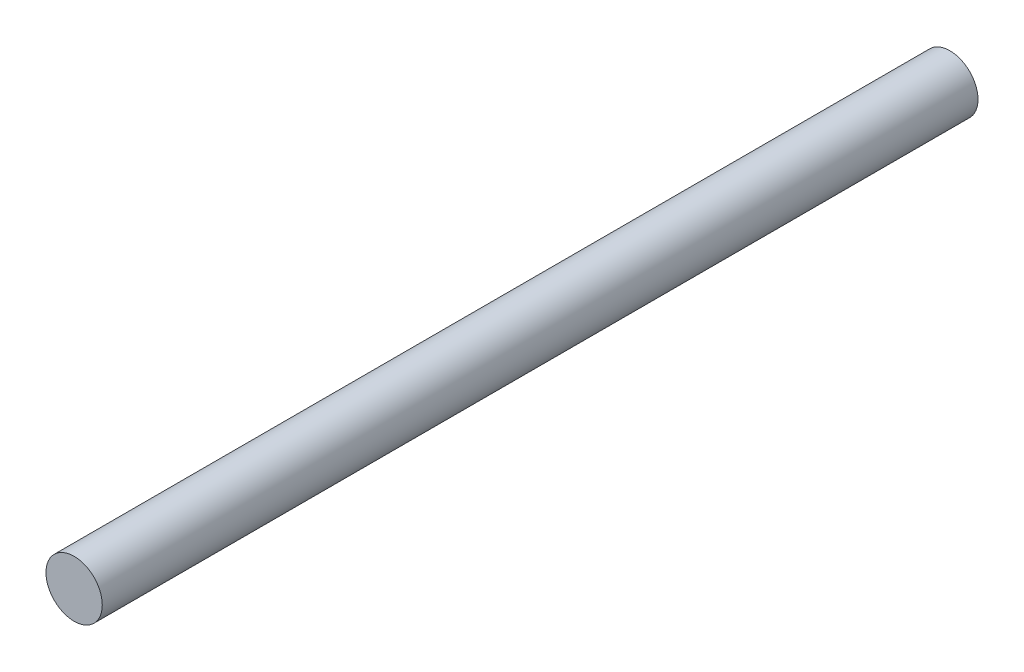
from build123d import *

# Parameters (mm, degrees)
BOSS_EXTRUDE1_DEPTH      = 33.2
BOSS_EXTRUDE1_DEPTH_BACK = 243.2
SKETCH1_R                = 8.89


with BuildPart() as part:
    # Sketch1 → Boss-Extrude1 (new, two sides: drawn at the far end of the back side and taken through both)
    with BuildSketch(Plane.XY.offset(-BOSS_EXTRUDE1_DEPTH_BACK)):
        Circle(SKETCH1_R)
    extrude(amount=BOSS_EXTRUDE1_DEPTH + BOSS_EXTRUDE1_DEPTH_BACK)


solid = part.part
